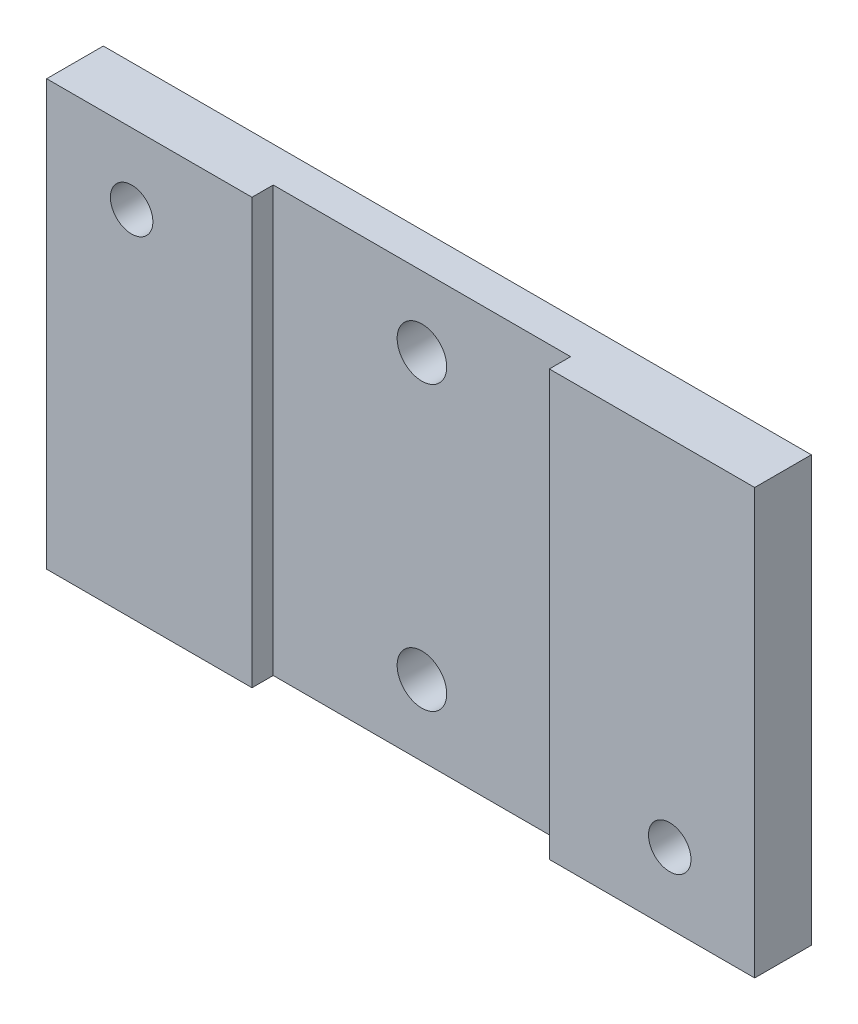
from build123d import *

# Parameters (mm, degrees)
SKETCH1_W           = 50
SKETCH1_H           = 30
SKETCH1_R           = 1.5
BOSS_EXTRUDE1_DEPTH = 4
SKETCH2_W           = 21
SKETCH2_H           = 30
CUT_EXTRUDE1_DEPTH  = 1.5
SKETCH3_R           = 1.75
CUT_EXTRUDE2_DEPTH  = 5


with BuildPart() as part:
    # Sketch1 → Boss-Extrude1 (new body)
    with BuildSketch(Plane.XY):
        with Locations((25, 15)):
            Rectangle(SKETCH1_W, SKETCH1_H)
        with Locations((6, 25)):
            Circle(SKETCH1_R, mode=Mode.SUBTRACT)
        with Locations((44, 5)):
            Circle(SKETCH1_R, mode=Mode.SUBTRACT)
    extrude(amount=BOSS_EXTRUDE1_DEPTH)

    # Sketch2 → Cut-Extrude1 (cut)
    with BuildSketch(Plane.XY.offset(4)):
        with Locations((25, 15)):
            Rectangle(SKETCH2_W, SKETCH2_H)
    extrude(amount=-CUT_EXTRUDE1_DEPTH, mode=Mode.SUBTRACT)

    # Sketch3 → Cut-Extrude2 (cut)
    with BuildSketch(Plane.XY.offset(2.5)):
        with Locations((25, 25)):
            Circle(SKETCH3_R)
        with Locations((25, 5)):
            Circle(SKETCH3_R)
    extrude(amount=-CUT_EXTRUDE2_DEPTH, mode=Mode.SUBTRACT)


solid = part.part
